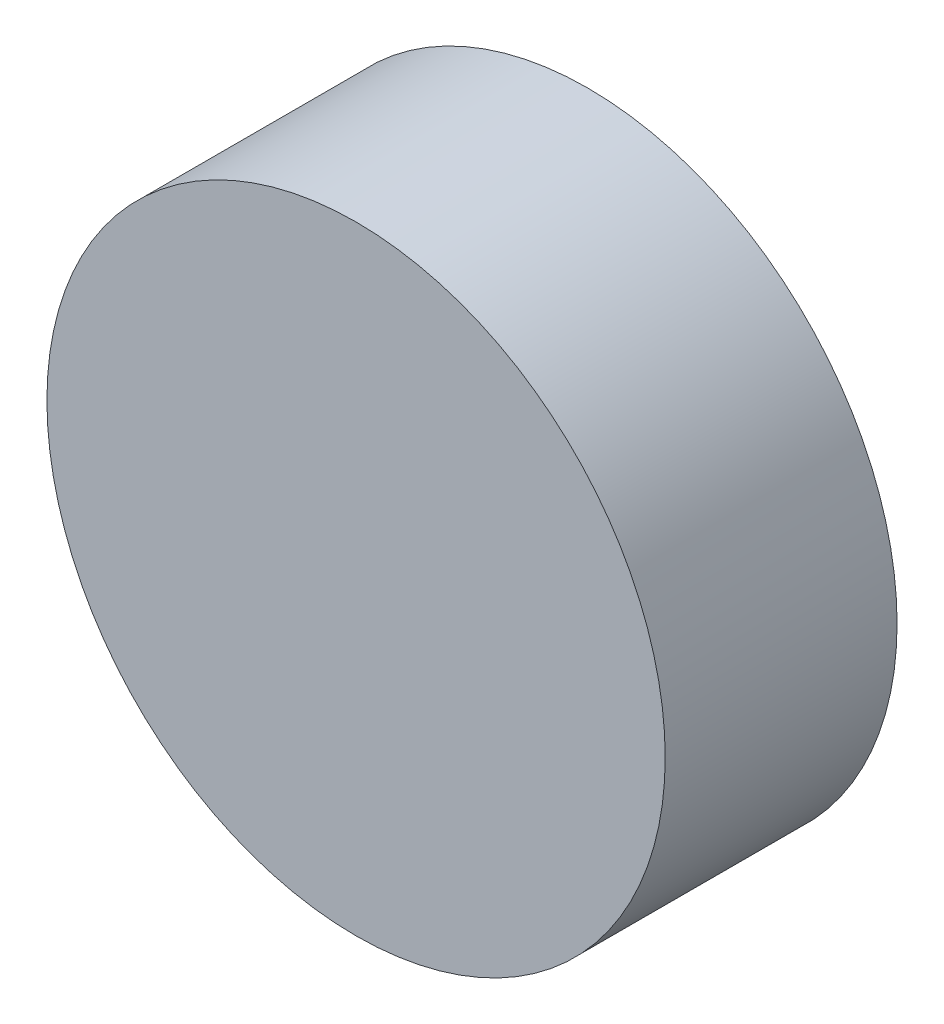
from build123d import *

# Parameters (mm, degrees)
SZKIC1_R                    = 14
DODANIE_WYCI_GNI_CIE1_DEPTH = 10.5


with BuildPart() as part:
    # Szkic1 → Dodanie-wyciągnięcie1 (new body)
    with BuildSketch(Plane.XY):
        with Locations(Location((0, 0, 0), (0, 0, 180))):
            Circle(SZKIC1_R)
    extrude(amount=DODANIE_WYCI_GNI_CIE1_DEPTH)


solid = part.part
